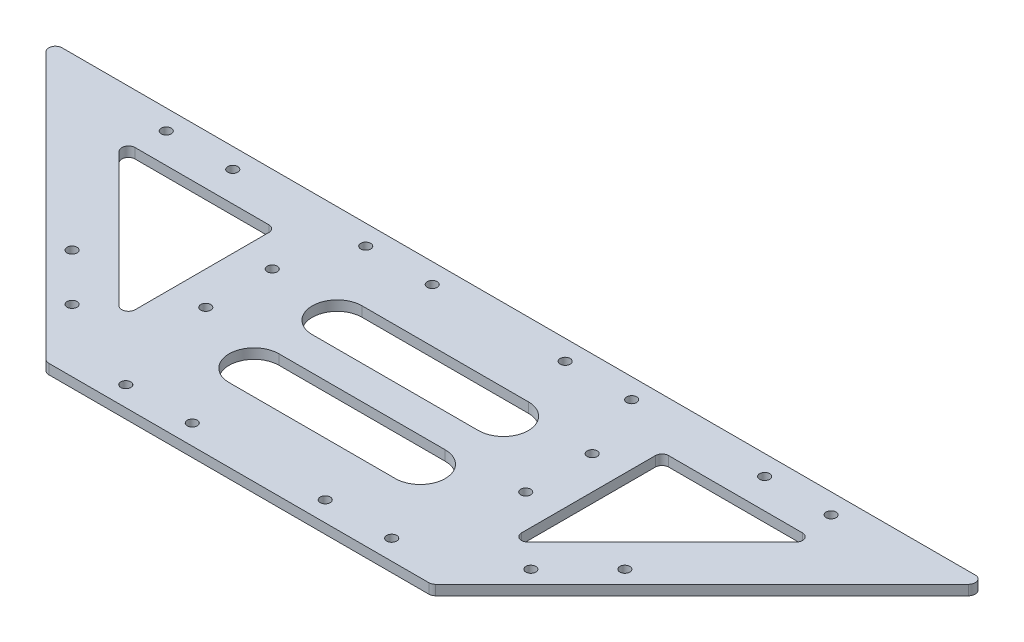
from build123d import *

# Parameters (mm, degrees)
SKETCH_1_W          = 116
SKETCH_1_H          = 84.18
SKETCH_1_R          = 1.5
EXTRUDE_1_DEPTH     = 3
CUT_EXTRUDE_1_DEPTH = 10
EXTRUDE_2_DEPTH     = 3
SKETCH_10_R         = 1.5
CUT_EXTRUDE_2_DEPTH = 149.309542849
CUT_EXTRUDE_3_DEPTH = 149.309542849
FILLET_2_R          = 2
FILLET_3_R          = 2
SKETCH_12_R         = 1.5
CUT_EXTRUDE_4_DEPTH = 10


with BuildPart() as part:
    # 草图1 → 凸台-拉伸1 (new body)
    with BuildSketch(Plane(origin=(0, 0, 0), x_dir=(1, 0, 0), z_dir=(0, 1, 0))):
        Rectangle(SKETCH_1_W, SKETCH_1_H)
        with Locations(Location((-40, 36.09, 0), (0, 0, 270))):
            Circle(SKETCH_1_R, mode=Mode.SUBTRACT)
        with Locations(Location((-20, 36.09, 0), (0, 0, 270))):
            Circle(SKETCH_1_R, mode=Mode.SUBTRACT)
        with Locations(Location((-48.125, 16.09, 0), (0, 0, 270))):
            Circle(SKETCH_1_R, mode=Mode.SUBTRACT)
        with Locations(Location((-48.125, -3.91, 0), (0, 0, 270))):
            Circle(SKETCH_1_R, mode=Mode.SUBTRACT)
        with Locations(Location((48.125, -3.91, 0), (0, 0, 90))):
            Circle(SKETCH_1_R, mode=Mode.SUBTRACT)
        with Locations(Location((48.125, 16.09, 0), (0, 0, 90))):
            Circle(SKETCH_1_R, mode=Mode.SUBTRACT)
        with Locations(Location((20, 36.09, 0), (0, 0, 90))):
            Circle(SKETCH_1_R, mode=Mode.SUBTRACT)
        with Locations(Location((40, 36.09, 0), (0, 0, 90))):
            Circle(SKETCH_1_R, mode=Mode.SUBTRACT)
        with Locations(Location((40, -36.09, 0), (0, 0, 270))):
            Circle(SKETCH_1_R, mode=Mode.SUBTRACT)
        with Locations(Location((20, -36.09, 0), (0, 0, 270))):
            Circle(SKETCH_1_R, mode=Mode.SUBTRACT)
        with Locations(Location((-20, -36.09, 0), (0, 0, 90))):
            Circle(SKETCH_1_R, mode=Mode.SUBTRACT)
        with Locations(Location((-40, -36.09, 0), (0, 0, 90))):
            Circle(SKETCH_1_R, mode=Mode.SUBTRACT)
    extrude(amount=EXTRUDE_1_DEPTH)

    # 草图2 → 切除-拉伸1 (cut)
    with BuildSketch(Plane(origin=(0, 3, 0), x_dir=(1, 0, 0), z_dir=(0, 1, 0))):
        with BuildLine():
            Line((-25, 20), (25, 20))
            ThreePointArc((25, 20), (32.5, 12.5), (25, 5))
            Line((25, 5), (-25, 5))
            ThreePointArc((-25, 5), (-32.5, 12.5), (-25, 20))
        make_face()
        with BuildLine():
            Line((-25, -20), (25, -20))
            ThreePointArc((25, -20), (32.5, -12.5), (25, -5))
            Line((25, -5), (-25, -5))
            ThreePointArc((-25, -5), (-32.5, -12.5), (-25, -20))
        make_face()
    extrude(amount=-CUT_EXTRUDE_1_DEPTH, mode=Mode.SUBTRACT)

    # 草图4 → 凸台-拉伸2 (add)
    with BuildSketch(Plane(origin=(0, 3, 0), x_dir=(1, 0, 0), z_dir=(0, 1, 0))):
        Polygon((58, 42.09), (142.18, 42.09), (58, -42.09), align=None)
        Polygon((-58, -42.09), (-58, 42.09), (-142.18, 42.09), align=None)
    extrude(amount=-EXTRUDE_2_DEPTH)

    # 草图10 → 切除-拉伸2 (cut, through all)
    with BuildSketch(Plane(origin=(0, 0, 0), x_dir=(-1, 0, 0), z_dir=(0, -1, 0))):
        with Locations(Location((69.000844337, -23.24902983, 0), (0, 0, 90))):
            Circle(SKETCH_10_R)
        with Locations(Location((83.142979961, -9.106894206, 0), (0, 0, 90))):
            Circle(SKETCH_10_R)
        with Locations(Location((-83.142979961, -9.106894206, 0), (0, 0, 270))):
            Circle(SKETCH_10_R)
        with Locations(Location((-69.000844337, -23.24902983, 0), (0, 0, 270))):
            Circle(SKETCH_10_R)
    extrude(amount=-CUT_EXTRUDE_2_DEPTH, mode=Mode.SUBTRACT)

    # 草图11 → 切除-拉伸3 (cut, through all)
    with BuildSketch(Plane(origin=(0, 3, 0), x_dir=(1, 0, 0), z_dir=(0, 1, 0))):
        Polygon((-105.197738543, 27.09), (-58.125, 27.09), (-58.125, -19.982738543), align=None)
        Polygon((58.125, -19.982738543), (105.197738543, 27.09), (58.125, 27.09), align=None)
    extrude(amount=-CUT_EXTRUDE_3_DEPTH, mode=Mode.SUBTRACT)

    # 圆角2
    fillet_2_edges = [part.edges().sort_by_distance(p)[0] for p in [
        (-58.125, 1.5, 19.982738543),
        (-105.197738543, 1.5, -27.09),
        (-58.125, 1.5, -27.09),
        (58.125, 1.5, 19.982738543),
        (58.125, 1.5, -27.09),
        (105.197738543, 1.5, -27.09),
    ]]
    fillet(fillet_2_edges, radius=FILLET_2_R)

    # 圆角3
    fillet_3_edges = [part.edges().sort_by_distance(p)[0] for p in [
        (142.18, 1.5, -42.09),
        (-142.18, 1.5, -42.09),
        (58, 1.5, 42.09),
        (-58, 1.5, 42.09),
    ]]
    fillet(fillet_3_edges, radius=FILLET_3_R)

    # 草图12 → 切除-拉伸4 (cut)
    with BuildSketch(Plane(origin=(0, 0, 0), x_dir=(-1, 0, 0), z_dir=(0, -1, 0))):
        with Locations(Location((-100, 36.089415022, 0), (0, 0, 90))):
            Circle(SKETCH_12_R)
        with Locations(Location((-80, 36.089415022, 0), (0, 0, 90))):
            Circle(SKETCH_12_R)
        with Locations(Location((80, 36.089415022, 0), (0, 0, 270))):
            Circle(SKETCH_12_R)
        with Locations(Location((100, 36.089415022, 0), (0, 0, 270))):
            Circle(SKETCH_12_R)
    extrude(amount=-CUT_EXTRUDE_4_DEPTH, mode=Mode.SUBTRACT)


solid = part.part
